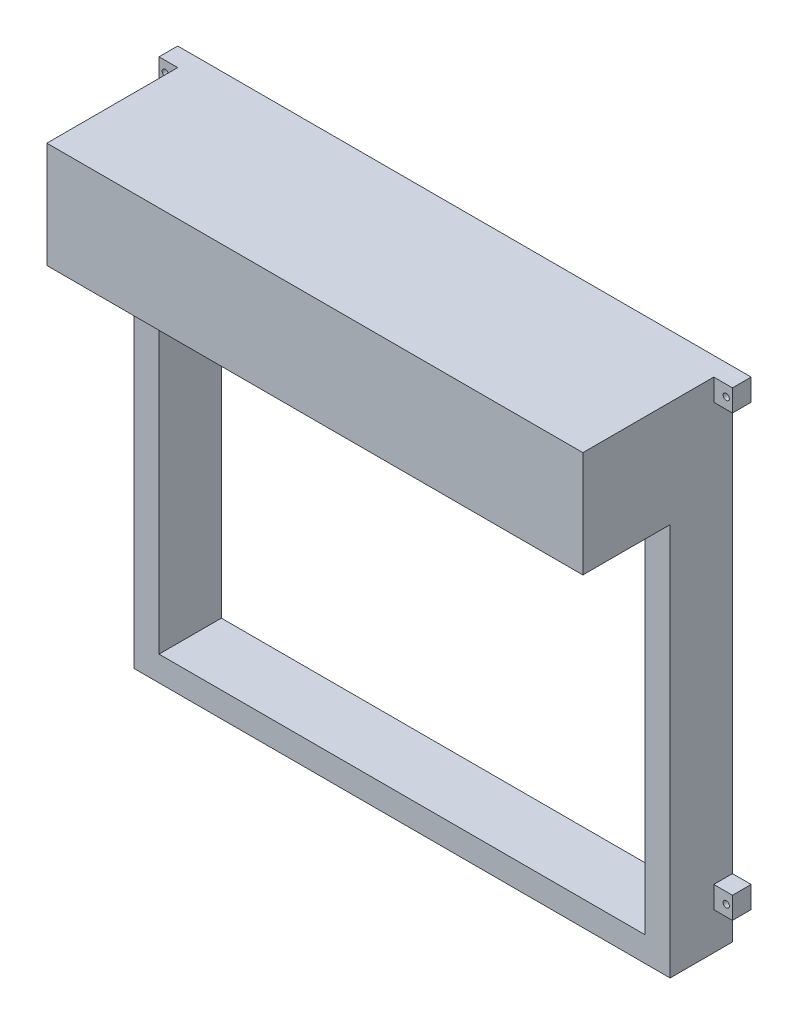
from build123d import *

# Parameters (mm, degrees)
EXTRUDE_1_DEPTH = 100
EXTRUDE_2_DEPTH = 240
SKETCH_1_4_W    = 30
SKETCH_1_4_H    = 35
SKETCH_1_4_R    = 5
EXTRUDE_3_DEPTH = 30


with BuildPart() as part:
    # Эскиз1 → Бобышка-Вытянуть1 (new body)
    with BuildSketch(Plane.XY):
        Polygon((0, 60), (0, 0), (860, 0), (860, 60), (860, 95), (860, 630), (820, 630), (820, 40), (40, 40), (40, 630), (0, 630), (0, 95), align=None)
    extrude(amount=EXTRUDE_1_DEPTH)

    # Эскиз1<3> → Бобышка-Вытянуть2 (add)
    with BuildSketch(Plane.XY):
        Polygon((0, 765), (0, 630), (40, 630), (820, 630), (860, 630), (860, 765), (860, 800), (0, 800), align=None)
    extrude(amount=EXTRUDE_2_DEPTH)

    # Эскиз1<4> → Бобышка-Вытянуть3 (add)
    # profile 1 of 4: a face of its own
    with BuildSketch(Plane.XY):
        with Locations((-15, 77.5)):
            Rectangle(SKETCH_1_4_W, SKETCH_1_4_H)
        with Locations((-20, 77.5)):
            Circle(SKETCH_1_4_R, mode=Mode.SUBTRACT)
    # profile 2 of 4: a face of its own
    with BuildSketch(Plane.XY):
        with Locations((875, 77.5)):
            Rectangle(SKETCH_1_4_W, SKETCH_1_4_H)
        with Locations((880, 77.5)):
            Circle(SKETCH_1_4_R, mode=Mode.SUBTRACT)
    # profile 3 of 4: a face of its own
    with BuildSketch(Plane.XY):
        with Locations((-15, 782.5)):
            Rectangle(SKETCH_1_4_W, SKETCH_1_4_H)
        with Locations((-20, 782.720518287)):
            Circle(SKETCH_1_4_R, mode=Mode.SUBTRACT)
    # profile 4 of 4: a face of its own
    with BuildSketch(Plane.XY):
        with Locations((875, 782.5)):
            Rectangle(SKETCH_1_4_W, SKETCH_1_4_H)
        with Locations((880, 782.5)):
            Circle(SKETCH_1_4_R, mode=Mode.SUBTRACT)
    extrude(amount=EXTRUDE_3_DEPTH)


solid = part.part
